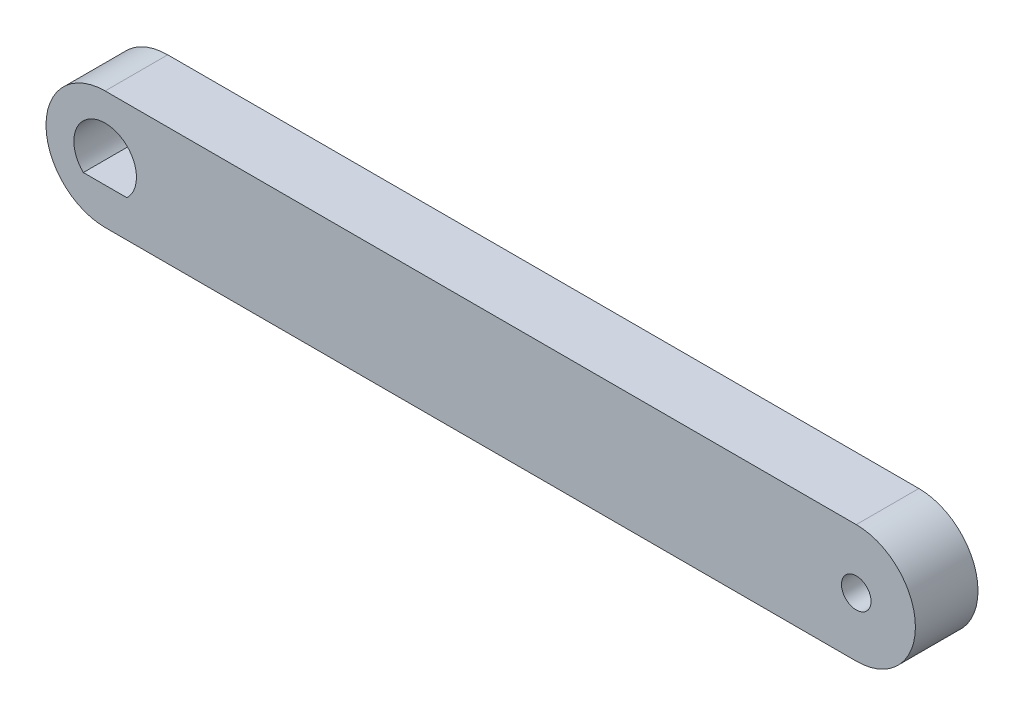
from build123d import *

# Parameters (mm, degrees)
BOSS_EXTRU_1_DEPTH      = 6.35
ENL_V_MAT_EXTRU_1_REACH = 84.663
ESQUISSE3_R             = 1.5
ENL_V_MAT_EXTRU_2_DEPTH = 6.35


with BuildPart() as part:
    # Esquisse1 → Boss.-Extru.1 (new body)
    with BuildSketch(Plane.XY):
        with BuildLine():
            Line((0, 6), (76.2, 6))
            ThreePointArc((76.2, 6), (82.2, 0), (76.2, -6))
            Line((76.2, -6), (0, -6))
            ThreePointArc((0, -6), (-6, 0), (0, 6))
        make_face()
    extrude(amount=BOSS_EXTRU_1_DEPTH)

    # Esquisse2 → Enlèv. mat.-Extru.1 (cut, up to next)
    with BuildSketch(Plane.XY.offset(6.35), mode=Mode.PRIVATE) as enl_v_mat_extru_1_sk1:
        with BuildLine():
            Line((-2.214723459, -2.275), (2.214723459, -2.275))
            ThreePointArc((2.214723459, -2.275), (0, 3.175), (-2.214723459, -2.275))
        make_face()
    enl_v_mat_extru_1_tool1 = extrude(enl_v_mat_extru_1_sk1.sketch, amount=-ENL_V_MAT_EXTRU_1_REACH, mode=Mode.PRIVATE) & part.part
    add(enl_v_mat_extru_1_tool1.solids().sort_by_distance((0, 0.25037, 6.35))[0], mode=Mode.SUBTRACT)

    # Esquisse3 → Enlèv. mat.-Extru.2 (cut)
    with BuildSketch(Plane.XY.offset(6.35)):
        with Locations((76.2, 0)):
            Circle(ESQUISSE3_R)
    extrude(amount=-ENL_V_MAT_EXTRU_2_DEPTH, mode=Mode.SUBTRACT)


solid = part.part
